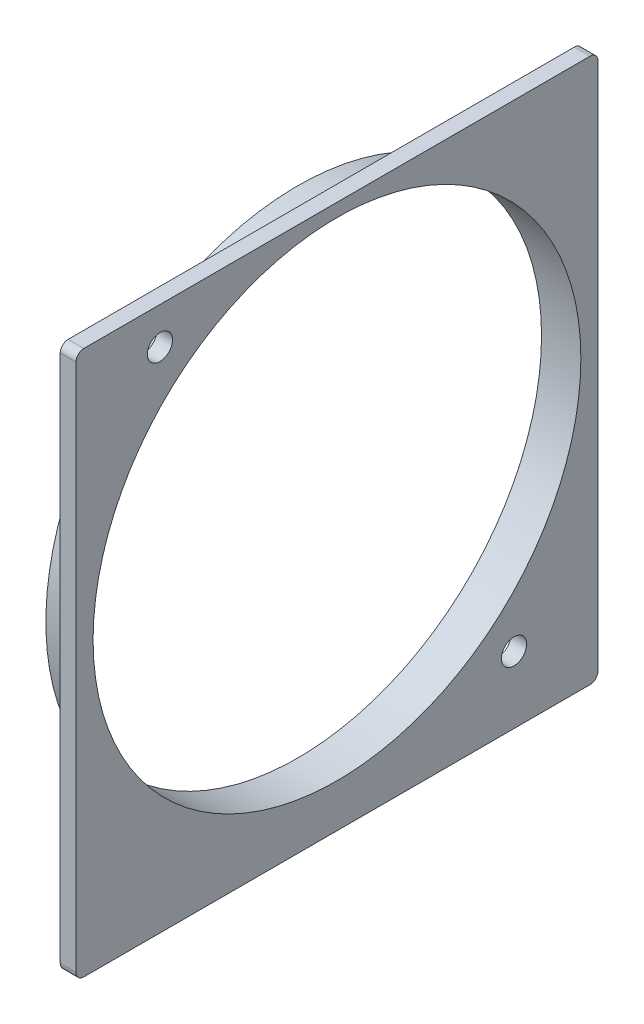
from build123d import *

# Parameters (mm, degrees)
SKETCH1_W            = 66.35
SKETCH1_H            = 69.18
BOSS_EXTRUDE1_DEPTH  = 2
SKETCH2_R            = 31
CUT_EXTRUDE1_DEPTH   = 48.969247701
M3_CLEARANCE_HOLE1_D = 3.2
BOSS_EXTRUDE2_START  = -3
SKETCH6_R            = 32
SKETCH6_R_2          = 31
BOSS_EXTRUDE2_DEPTH  = 3
FILLET1_R            = 1


with BuildPart() as part:
    # Sketch1 → Boss-Extrude1 (new body)
    with BuildSketch(Plane(origin=(0, 0, 0), x_dir=(0, 0, -1), z_dir=(1, 0, 0))):
        Rectangle(SKETCH1_W, SKETCH1_H)
    extrude(amount=BOSS_EXTRUDE1_DEPTH)

    # Sketch2 → Cut-Extrude1 (cut, through all)
    with BuildSketch(Plane.ZY):
        with Locations((0, 1.91)):
            Circle(SKETCH2_R)
    extrude(amount=-CUT_EXTRUDE1_DEPTH, mode=Mode.SUBTRACT)

    # M3 Clearance Hole1 (through all)
    with Locations(Plane(origin=(2, 0, 0), x_dir=(0, 0, -1), z_dir=(1, 0, 0))):
        with Locations((-22.5, 29.91), (22.5, -26.09)):
            Hole(M3_CLEARANCE_HOLE1_D / 2)

    # Sketch6 → Boss-Extrude2 (add)
    with BuildSketch(Plane(origin=(0, 0, 0), x_dir=(0, 0, -1), z_dir=(1, 0, 0)).offset(BOSS_EXTRUDE2_START)):
        with Locations((0, 1.91)):
            Circle(SKETCH6_R)
        with Locations(Location((0, 1.91, 0), (0, 0, 180))):
            Circle(SKETCH6_R_2, mode=Mode.SUBTRACT)
    extrude(amount=BOSS_EXTRUDE2_DEPTH)

    # Fillet1
    fillet1_edges = [part.edges().sort_by_distance(p)[0] for p in [
        (1, -34.59, -33.175),
        (1, -34.59, 33.175),
        (1, 34.59, 33.175),
        (1, 34.59, -33.175),
    ]]
    fillet(fillet1_edges, radius=FILLET1_R)


solid = part.part
